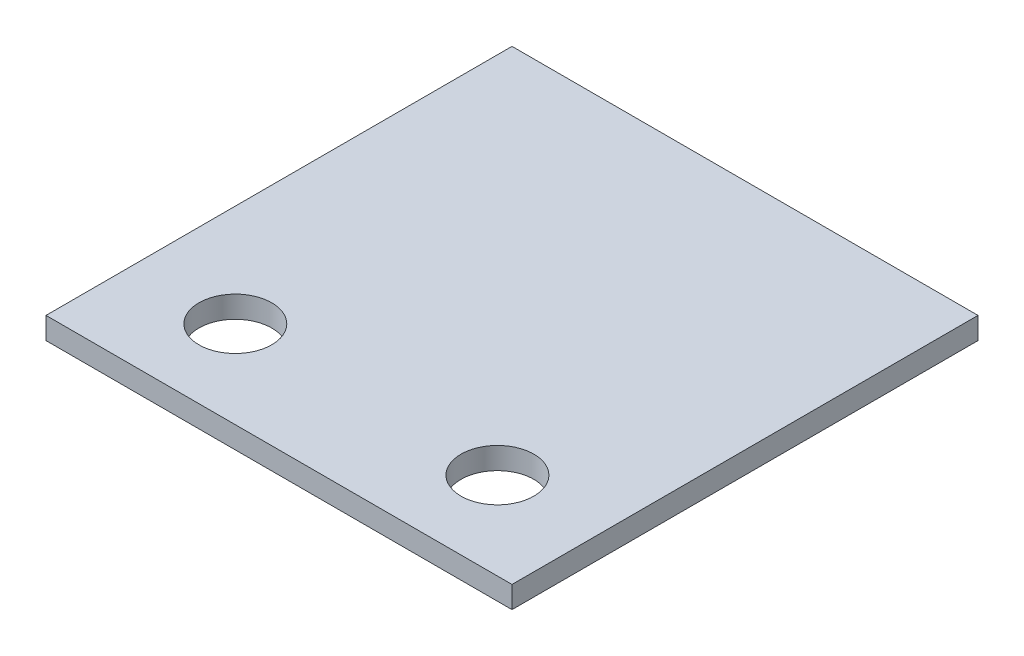
from build123d import *

# Parameters (mm, degrees)
SKETCH_1_W          = 32
SKETCH_1_H          = 32
EXTRUDE_1_DEPTH     = 1.5
SKETCH_2_R          = 2.5
CUT_EXTRUDE_1_DEPTH = 23.677080941


with BuildPart() as part:
    # 草图1 → 凸台-拉伸1 (new body)
    with BuildSketch(Plane(origin=(0, 0, 0), x_dir=(1, 0, 0), z_dir=(0, 1, 0))):
        Rectangle(SKETCH_1_W, SKETCH_1_H)
    extrude(amount=EXTRUDE_1_DEPTH)

    # 草图2 → 切除-拉伸1 (cut, through all)
    with BuildSketch(Plane(origin=(0, 1.5, 0), x_dir=(1, 0, 0), z_dir=(0, 1, 0))):
        with Locations(Location((9, -10, 0), (0, 0, 270))):
            Circle(SKETCH_2_R)
    cut_extrude_1 = extrude(amount=-CUT_EXTRUDE_1_DEPTH, mode=Mode.SUBTRACT)

    # 镜向1: 切除-拉伸1 across plane
    add(cut_extrude_1.mirror(Plane(origin=(0, 0, 0), x_dir=(0, 0, 1), z_dir=(1, 0, 0))), mode=Mode.SUBTRACT)


solid = part.part
